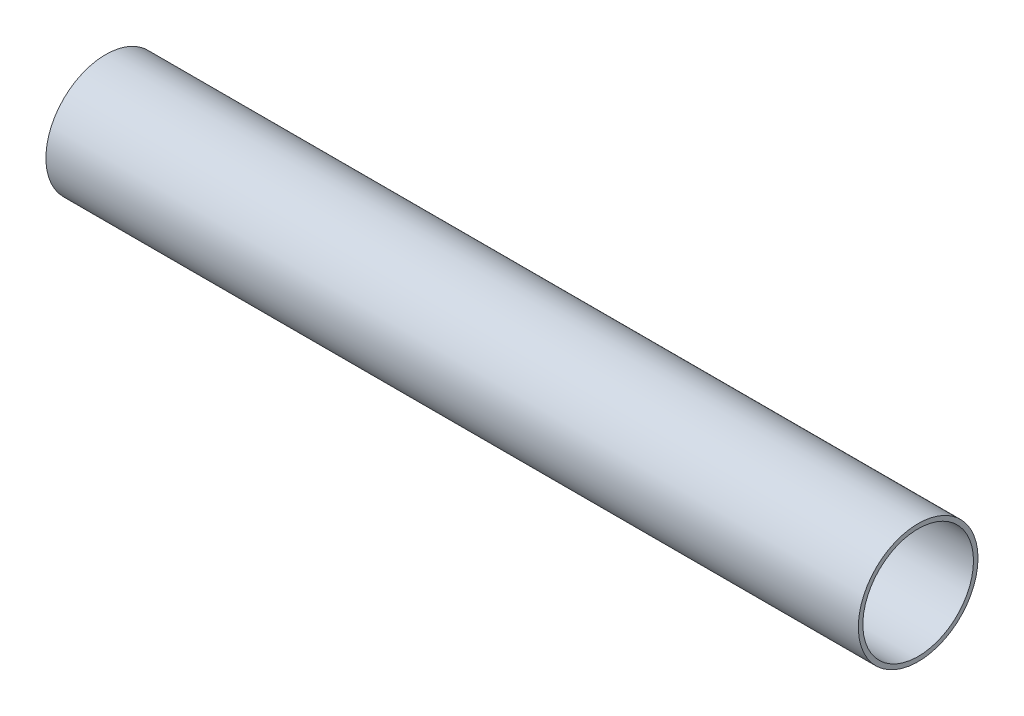
from build123d import *

# Parameters (mm, degrees)
SKETCH1_R           = 17.171437949
SKETCH1_R_2         = 15.875
BOSS_EXTRUDE1_DEPTH = 116.571624997


with BuildPart() as part:
    # Sketch1 → Boss-Extrude1 (new, symmetric)
    with BuildSketch(Plane(origin=(0, 0, 0), x_dir=(0, 0, -1), z_dir=(1, 0, 0))):
        Circle(SKETCH1_R)
        Circle(SKETCH1_R_2, mode=Mode.SUBTRACT)
    extrude(amount=BOSS_EXTRUDE1_DEPTH, both=True)


solid = part.part
